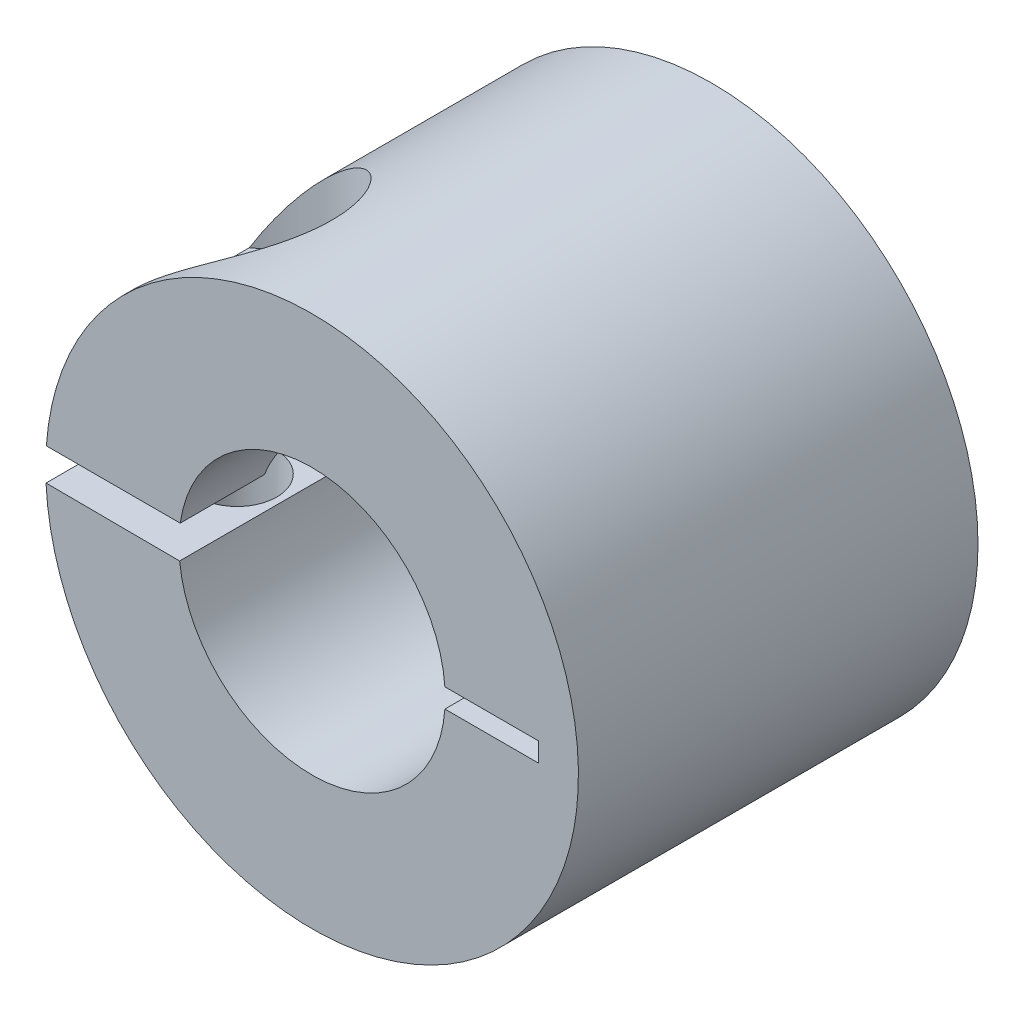
from build123d import *

# Parameters (mm, degrees)
EXTRUDE_1_DEPTH        = 11
SKETCH_6_R             = 5
CUT_EXTRUDE_2_DEPTH    = 15
SKETCH_7_R             = 2.75
CUT_EXTRUDE_3_DEPTH    = 6
EXTRUDE_START          = 10
SKETCH_18_R            = 14
SKETCH_18_R_2          = 7
EXTRUDE_2_DEPTH        = 10
HOLE_WIZARD_M5_2_D     = 4.2
HOLE_WIZARD_M5_2_DEPTH = 19
HOLE_WIZARD_M5_2_TIP   = 1.2618073


with BuildPart() as part:
    # 草图1 → 凸台-拉伸1 (new body)
    with BuildSketch(Plane.XY):
        with BuildLine():
            Line((-13.964240044, 1), (-6.92820323, 1))
            ThreePointArc((-6.92820323, 1), (6.998743905, -0.13260372), (-6.96111081, -0.736842105))
            Line((-6.96111081, -0.736842105), (-13.982489049, -0.7))
            ThreePointArc((-13.982489049, -0.7), (13.999193432, -0.150277266), (-13.964240044, 1))
        make_face()
    extrude(amount=EXTRUDE_1_DEPTH)

    # 切除-扫描1: sweep along a path in 草图3
    with BuildLine(Plane(origin=(0, 0, 0), x_dir=(1, 0, 0), z_dir=(0, 1, 0))) as sweep_1_path:
        Line((11.898777818, -11), (9.4677896, -8.569011782))
    # 草图2 → 切除-扫描1 (sweep, cut)
    with BuildSketch(Plane.XY.offset(11)):
        with BuildLine():
            Line((6.981701169, 0.505814966), (11.898777818, 0.505814966))
            Line((11.898777818, 0.505814966), (11.898777818, -0.505814966))
            Line((11.898777818, -0.505814966), (6.981701169, -0.505814966))
            ThreePointArc((6.981701169, -0.505814966), (7, 0), (6.981701169, 0.505814966))
        make_face()
    sweep(path=sweep_1_path.line, mode=Mode.SUBTRACT)

    # 草图6 → 切除-拉伸2 (cut)
    with BuildSketch(Plane(origin=(0, 6, 0), x_dir=(1, 0, 0), z_dir=(0, 1, 0))):
        with Locations((-9.464240044, -5.5)):
            Circle(SKETCH_6_R)
    extrude(amount=CUT_EXTRUDE_2_DEPTH, mode=Mode.SUBTRACT)

    # 草图7 → 切除-拉伸3 (cut)
    with BuildSketch(Plane(origin=(0, 6, 0), x_dir=(1, 0, 0), z_dir=(0, 1, 0))):
        with Locations(Location((-9.464240044, -5.5, 0), (0, 0, 270))):
            Circle(SKETCH_7_R)
    extrude(amount=-CUT_EXTRUDE_3_DEPTH, mode=Mode.SUBTRACT)

    # 草图18 → 凸台-拉伸2 (add)
    with BuildSketch(Plane(origin=(0, 0, 0), x_dir=(-1, 0, 0), z_dir=(0, 0, -1)).offset(EXTRUDE_START)):
        Circle(SKETCH_18_R)
        Circle(SKETCH_18_R_2, mode=Mode.SUBTRACT)
    extrude(amount=-EXTRUDE_2_DEPTH)

    # M5 螺纹孔2
    with Locations(Plane(origin=(-0.004057853, -0.773346687, 0), x_dir=(0.9999862340820442, -0.005247060740183186, 0), z_dir=(0.005247060740183185, 0.9999862340820441, 0))):
        with Locations((-9.411026536, -5.540271142)):
            Hole(HOLE_WIZARD_M5_2_D / 2, depth=HOLE_WIZARD_M5_2_DEPTH)
            with Locations((0, 0, -(HOLE_WIZARD_M5_2_DEPTH + HOLE_WIZARD_M5_2_TIP / 2))):  # 118° drill point
                Cone(0, HOLE_WIZARD_M5_2_D / 2, HOLE_WIZARD_M5_2_TIP, mode=Mode.SUBTRACT)


solid = part.part
